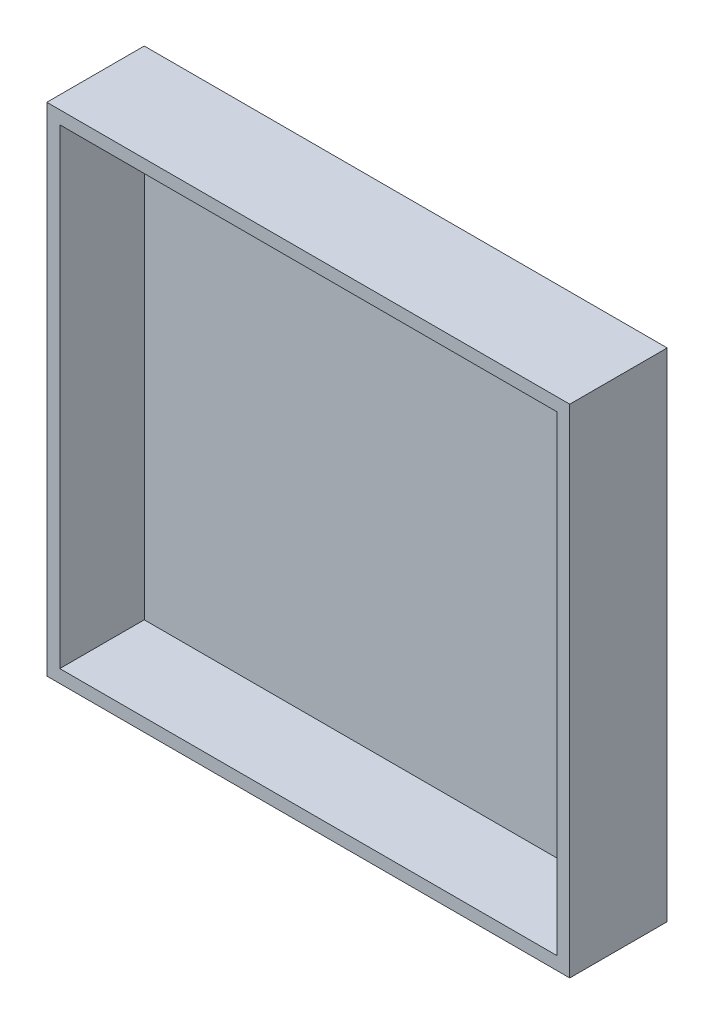
from build123d import *

# Parameters (mm, degrees)
ESQUISSE1_W        = 80.5
ESQUISSE1_H        = 76.5
BOSS_EXTRU_1_DEPTH = 2
ESQUISSE2_W        = 80.5
ESQUISSE2_H        = 76.5
ESQUISSE2_W_2      = 76.5
ESQUISSE2_H_2      = 72.5
BOSS_EXTRU_2_DEPTH = 13


with BuildPart() as part:
    # Esquisse1 → Boss.-Extru.1 (new body)
    with BuildSketch(Plane.XY):
        with Locations((-29.888593491, 8.305760709)):
            Rectangle(ESQUISSE1_W, ESQUISSE1_H)
    extrude(amount=BOSS_EXTRU_1_DEPTH)

    # Esquisse2 → Boss.-Extru.2 (add)
    with BuildSketch(Plane.XY.offset(2)):
        with Locations((-29.888593491, 8.305760709)):
            Rectangle(ESQUISSE2_W, ESQUISSE2_H)
        with Locations((-29.888593491, 8.305760709)):
            Rectangle(ESQUISSE2_W_2, ESQUISSE2_H_2, mode=Mode.SUBTRACT)
    extrude(amount=BOSS_EXTRU_2_DEPTH)


solid = part.part
